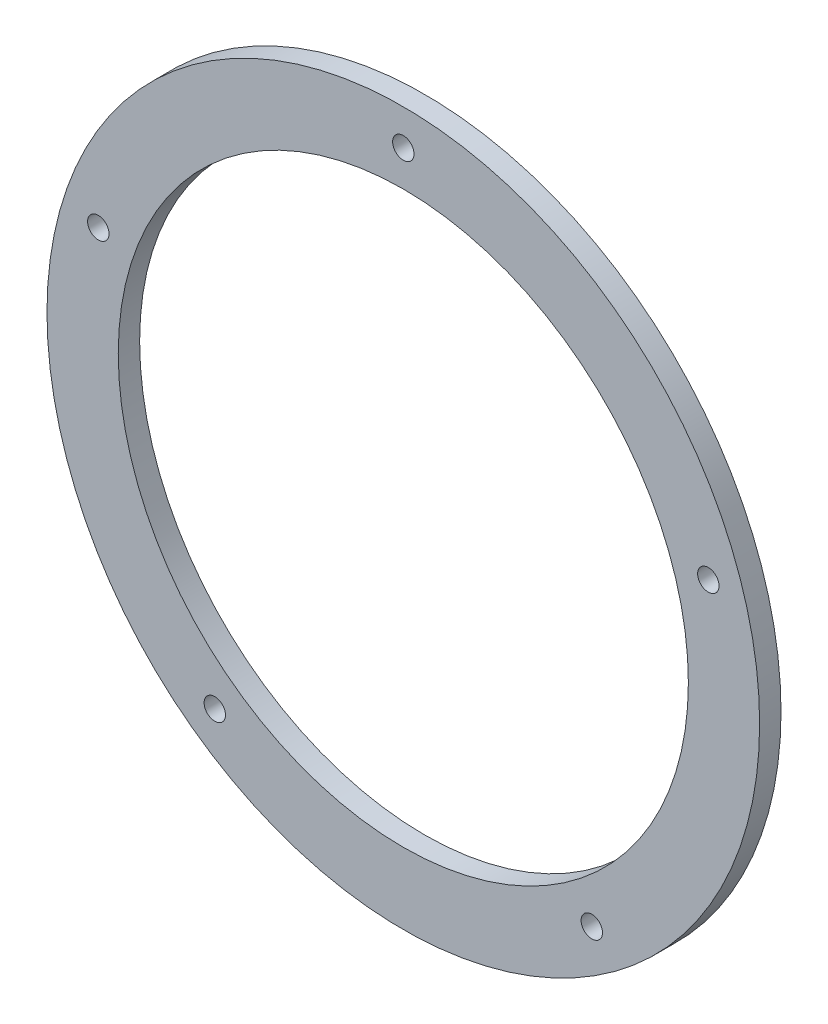
from build123d import *

# Parameters (mm, degrees)
SKETCH_1_R               = 50
SKETCH_1_R_2             = 40
EXTRUDE_1_DEPTH          = 3
SKETCH_2_R               = 1.5
CUT_EXTRUDE_1_DEPTH      = 71.774289117
PATTERN_CIRCULAR_1_COUNT = 5


with BuildPart() as part:
    # 草圖1 → 填料-伸長1 (new body)
    with BuildSketch(Plane.XY):
        Circle(SKETCH_1_R)
        Circle(SKETCH_1_R_2, mode=Mode.SUBTRACT)
    extrude(amount=EXTRUDE_1_DEPTH)

    # 草圖2 → 除料-伸長1 (cut, through all)
    with BuildSketch(Plane.XY.offset(3)):
        with Locations((0, 45)):
            Circle(SKETCH_2_R)
    cut_extrude_1 = extrude(amount=-CUT_EXTRUDE_1_DEPTH, mode=Mode.SUBTRACT)

    # 環狀複製排列1: 除料-伸長1 ×5 about axis
    pattern_circular_1_axis = Axis((0, 0, 0), (0, 0, 1))
    for i in range(1, PATTERN_CIRCULAR_1_COUNT):
        add(cut_extrude_1.rotate(pattern_circular_1_axis, i * 360 / PATTERN_CIRCULAR_1_COUNT), mode=Mode.SUBTRACT)


solid = part.part
